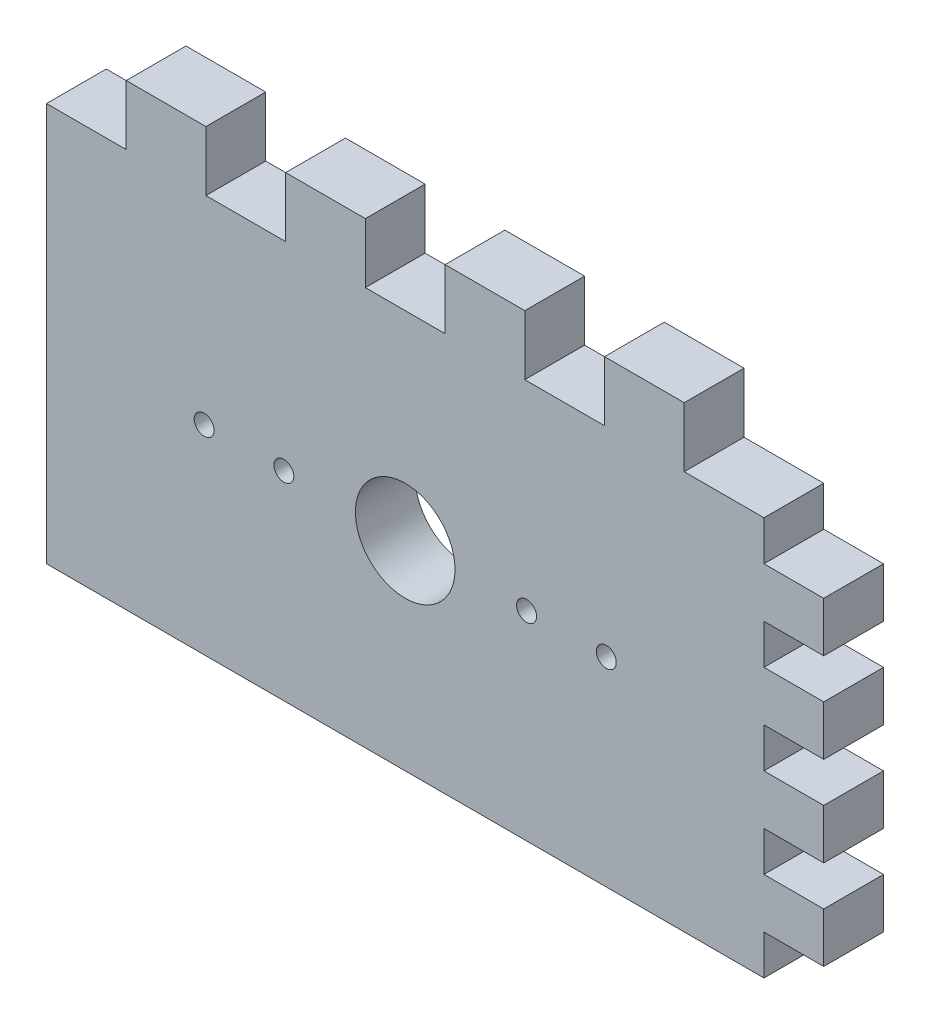
from build123d import *

# Parameters (mm, degrees)
SKETCH1_R           = 2.5
SKETCH1_R_2         = 0.5
BOSS_EXTRUDE1_DEPTH = 3


with BuildPart() as part:
    # Sketch1 → Boss-Extrude1 (new body)
    with BuildSketch(Plane.XY):
        Polygon((18, 10), (18, 8), (21, 8), (21, 5.5), (18, 5.5), (18, 3.5), (21, 3.5), (21, 1), (18, 1), (18, -1), (21, -1), (21, -3.5), (18, -3.5), (18, -5.5), (21, -5.5), (21, -8), (18, -8), (18, -10), (-18, -10), (-18, 10), (-14, 10), (-14, 13), (-10, 13), (-10, 10), (-6, 10), (-6, 13), (-2, 13), (-2, 10), (2, 10), (2, 13), (6, 13), (6, 10), (10, 10), (10, 13), (14, 13), (14, 10), align=None)
        Circle(SKETCH1_R, mode=Mode.SUBTRACT)
        with Locations((-6.09, 0)):
            Circle(SKETCH1_R_2, mode=Mode.SUBTRACT)
        with Locations((-10.09, 0)):
            Circle(SKETCH1_R_2, mode=Mode.SUBTRACT)
        with Locations(Location((10.09, 0, 0), (0, 0, 180))):
            Circle(SKETCH1_R_2, mode=Mode.SUBTRACT)
        with Locations(Location((6.09, 0, 0), (0, 0, 180))):
            Circle(SKETCH1_R_2, mode=Mode.SUBTRACT)
    extrude(amount=BOSS_EXTRUDE1_DEPTH)


solid = part.part
